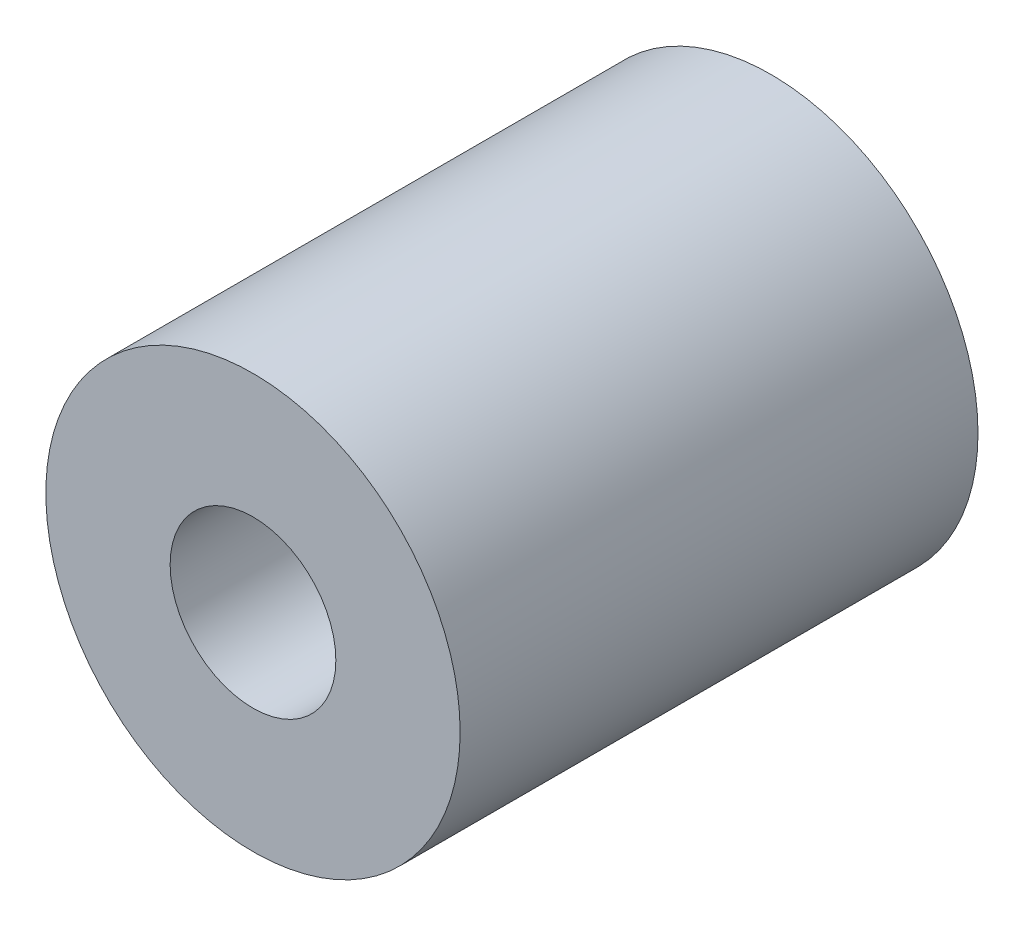
from build123d import *

# Parameters (mm, degrees)
SKETCH_1_R          = 10
SKETCH_1_R_2        = 4
EXTRUDE_1_DEPTH     = 25
SKETCH_2_R          = 5
CUT_EXTRUDE_1_DEPTH = 10


with BuildPart() as part:
    # 草图1 → 凸台-拉伸1 (new body)
    with BuildSketch(Plane.XY):
        Circle(SKETCH_1_R)
        Circle(SKETCH_1_R_2, mode=Mode.SUBTRACT)
    extrude(amount=EXTRUDE_1_DEPTH)

    # 草图2 → 切除-拉伸1 (cut)
    with BuildSketch(Plane(origin=(0, 0, 0), x_dir=(-1, 0, 0), z_dir=(0, 0, -1))):
        Circle(SKETCH_2_R)
    extrude(amount=-CUT_EXTRUDE_1_DEPTH, mode=Mode.SUBTRACT)


solid = part.part
